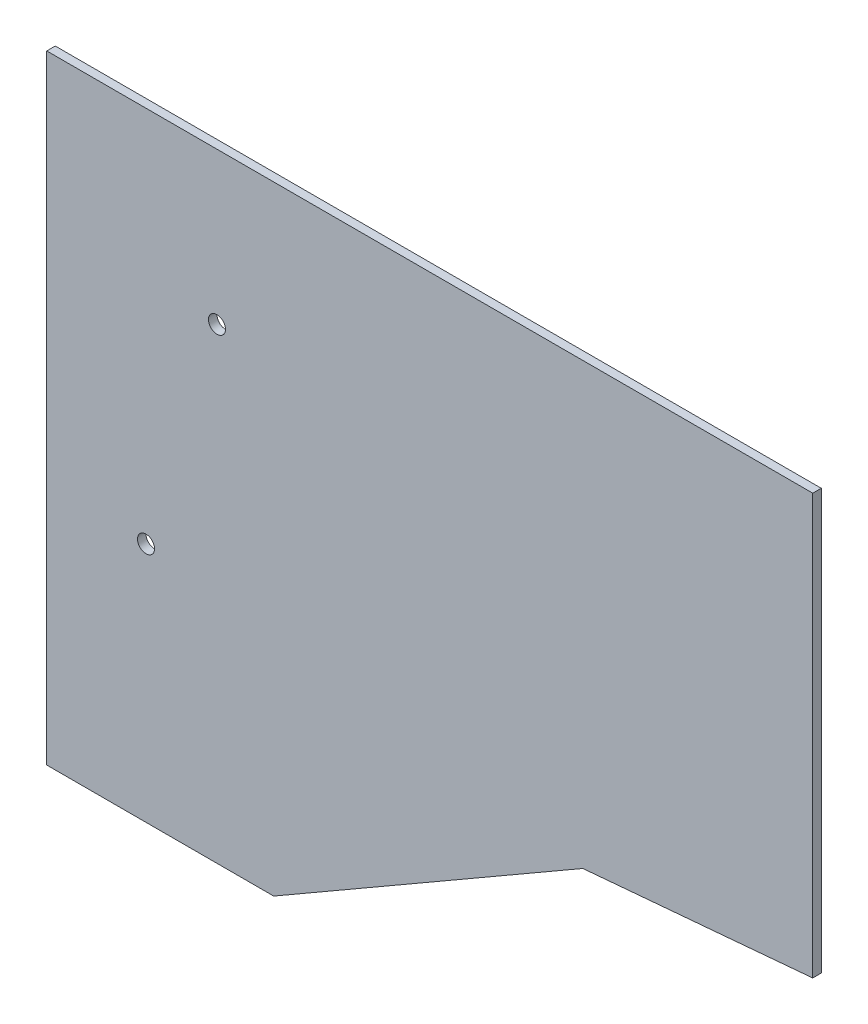
from build123d import *

# Parameters (mm, degrees)
ESQUISSE1_W                   = 270
ESQUISSE1_H                   = 218
BOSS_EXTRU_1_DEPTH            = 3
ESQUISSE3_R                   = 3
ENL_V_MAT_EXTRU_1_DEPTH       = 10
ESQUISSE4_R                   = 3
ENL_V_MAT_EXTRU_2_DEPTH       = 10
ENL_V_MAT_EXTRU_11_DEPTH      = 174.536739626
ENL_V_MAT_EXTRU_11_DEPTH_BACK = 174.536739626


with BuildPart() as part:
    # Esquisse1 → Boss.-Extru.1 (new body)
    with BuildSketch(Plane.XY):
        Rectangle(ESQUISSE1_W, ESQUISSE1_H)
    extrude(amount=BOSS_EXTRU_1_DEPTH)

    # Esquisse3 → Enlèv. mat.-Extru.1 (cut)
    with BuildSketch(Plane.XY.offset(3)):
        with Locations((-100, -24)):
            Circle(ESQUISSE3_R)
    extrude(amount=-ENL_V_MAT_EXTRU_1_DEPTH, mode=Mode.SUBTRACT)

    # Esquisse4 → Enlèv. mat.-Extru.2 (cut)
    with BuildSketch(Plane.XY.offset(3)):
        with Locations((-75, 55.5)):
            Circle(ESQUISSE4_R)
    extrude(amount=-ENL_V_MAT_EXTRU_2_DEPTH, mode=Mode.SUBTRACT)

    # Esquisse5 → Enlèv. mat.-Extru.11 (cut, two sides: drawn at the far end of the back side and taken through both)
    with BuildSketch(Plane.XY.offset(3).offset(-ENL_V_MAT_EXTRU_11_DEPTH_BACK)):
        Polygon((135, -39), (53.963742643, -46.089753853), (-55, -109), (135, -109), align=None)
    extrude(amount=ENL_V_MAT_EXTRU_11_DEPTH + ENL_V_MAT_EXTRU_11_DEPTH_BACK, mode=Mode.SUBTRACT)


solid = part.part
